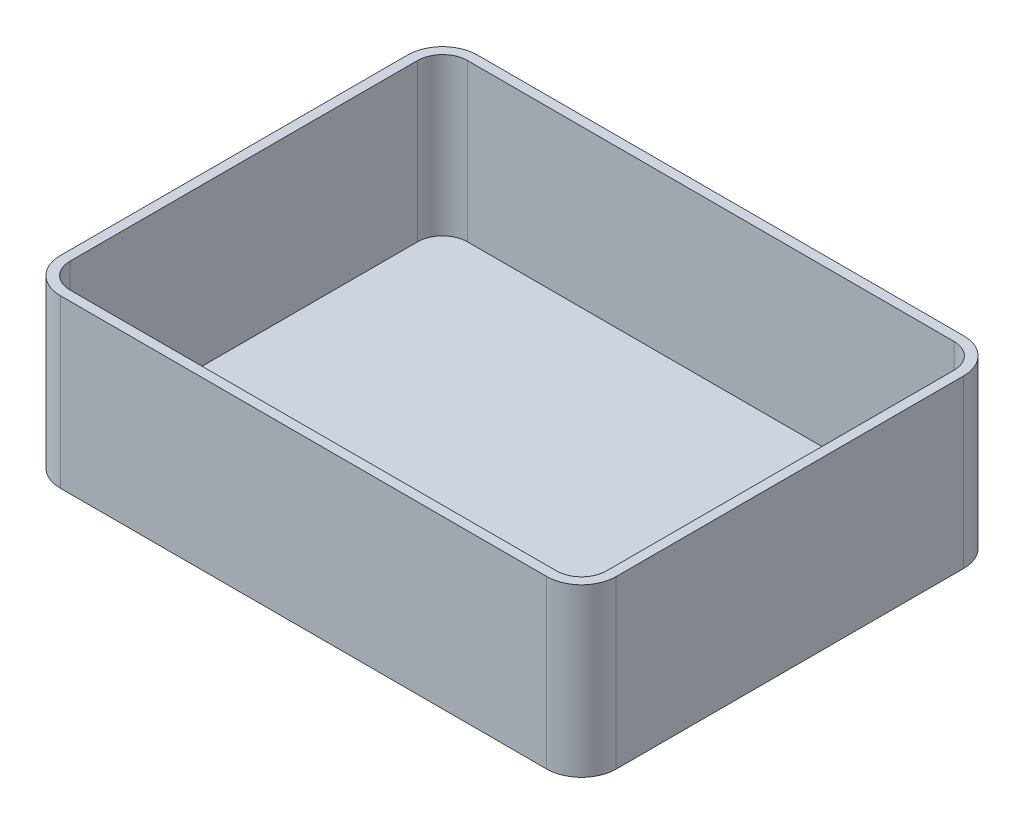
from build123d import *

# Parameters (mm, degrees)
BOSS_EXTRUDE1_DEPTH = 120
SHELL1_T            = -7


with BuildPart() as part:
    # Sketch1 → Boss-Extrude1 (new body)
    with BuildSketch(Plane(origin=(0, 0, 0), x_dir=(1, 0, 0), z_dir=(0, 1, 0))):
        with BuildLine():
            Line((-175, -150), (175, -150))
            ThreePointArc((175, -150), (192.67766953, -142.67766953), (200, -125))
            Line((200, -125), (200, 125))
            ThreePointArc((200, 125), (192.67766953, 142.67766953), (175, 150))
            Line((175, 150), (-175, 150))
            ThreePointArc((-175, 150), (-192.67766953, 142.67766953), (-200, 125))
            Line((-200, 125), (-200, -125))
            ThreePointArc((-200, -125), (-192.67766953, -142.67766953), (-175, -150))
        make_face()
    extrude(amount=BOSS_EXTRUDE1_DEPTH)

    # Shell1
    shell1_openings = [part.faces().sort_by_distance(p)[0] for p in [
        (0, 120, 0),
    ]]
    offset(amount=SHELL1_T, openings=shell1_openings, kind=Kind.INTERSECTION)


solid = part.part
